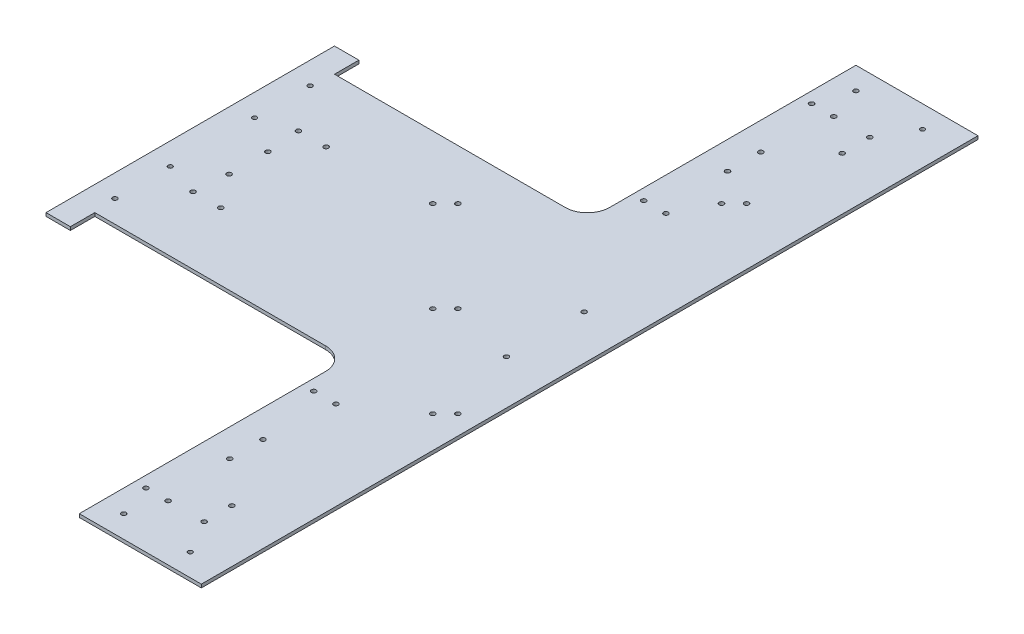
from build123d import *

# Parameters (mm, degrees)
BOSS_EXTRUDE1_DEPTH = 3
SKETCH2_R           = 2.125
CUT_EXTRUDE1_DEPTH  = 503.104570782
SKETCH3_R           = 2
CUT_EXTRUDE2_DEPTH  = 503.104570782
SKETCH5_R           = 2.125
CUT_EXTRUDE4_DEPTH  = 10
FILLET1_R           = 20
SKETCH6_R           = 2.125
CUT_EXTRUDE5_DEPTH  = 503.104570782
SKETCH8_R           = 2.1
CUT_EXTRUDE6_DEPTH  = 10
SKETCH7_R           = 2.1
CUT_EXTRUDE7_DEPTH  = 10
SKETCH9_W           = 360
SKETCH9_H           = 700
CUT_EXTRUDE8_DEPTH  = 10


with BuildPart() as part:
    # Sketch1 → Boss-Extrude1 (new body)
    with BuildSketch(Plane(origin=(0, 0, 0), x_dir=(1, 0, 0), z_dir=(0, 1, 0))):
        Polygon((-110, 350), (-110, 108), (-338, 108), (-338, 130), (-360, 130), (-360, -130), (-338, -130), (-338, -108), (-110, -108), (-110, -350), (110, -350), (110, -108), (338, -108), (338, -130), (360, -130), (360, 130), (338, 130), (338, 108), (110, 108), (110, 350), align=None)
    extrude(amount=BOSS_EXTRUDE1_DEPTH)

    # Sketch2 → Cut-Extrude1 (cut, through all)
    with BuildSketch(Plane(origin=(0, 3, 0), x_dir=(1, 0, 0), z_dir=(0, 1, 0))):
        with Locations(Location((310, 47.5, 0), (0, 0, 270))):
            Circle(SKETCH2_R)
        with Locations(Location((285, 47.5, 0), (0, 0, 270))):
            Circle(SKETCH2_R)
        with Locations(Location((307.5, 17.5, 0), (0, 0, 270))):
            Circle(SKETCH2_R)
        with Locations(Location((307.5, -17.5, 0), (0, 0, 270))):
            Circle(SKETCH2_R)
        with Locations(Location((310, -47.5, 0), (0, 0, 270))):
            Circle(SKETCH2_R)
        with Locations(Location((285, -47.5, 0), (0, 0, 270))):
            Circle(SKETCH2_R)
        with Locations(Location((-285, -47.5, 0), (0, 0, 90))):
            Circle(SKETCH2_R)
        with Locations(Location((-310, -47.5, 0), (0, 0, 90))):
            Circle(SKETCH2_R)
        with Locations(Location((-307.5, -17.5, 0), (0, 0, 90))):
            Circle(SKETCH2_R)
        with Locations(Location((-307.5, 17.5, 0), (0, 0, 90))):
            Circle(SKETCH2_R)
        with Locations(Location((-285, 47.5, 0), (0, 0, 90))):
            Circle(SKETCH2_R)
        with Locations(Location((-310, 47.5, 0), (0, 0, 90))):
            Circle(SKETCH2_R)
        with Locations(Location((47.5, 300, 0), (0, 0, 270))):
            Circle(SKETCH2_R)
        with Locations(Location((47.5, 275, 0), (0, 0, 270))):
            Circle(SKETCH2_R)
        with Locations(Location((-47.5, 275, 0), (0, 0, 90))):
            Circle(SKETCH2_R)
        with Locations(Location((-47.5, 300, 0), (0, 0, 90))):
            Circle(SKETCH2_R)
        with Locations(Location((-47.5, -300, 0), (0, 0, 270))):
            Circle(SKETCH2_R)
        with Locations(Location((-47.5, -275, 0), (0, 0, 270))):
            Circle(SKETCH2_R)
        with Locations(Location((47.5, -275, 0), (0, 0, 90))):
            Circle(SKETCH2_R)
        with Locations(Location((47.5, -300, 0), (0, 0, 90))):
            Circle(SKETCH2_R)
    extrude(amount=-CUT_EXTRUDE1_DEPTH, mode=Mode.SUBTRACT)

    # Sketch3 → Cut-Extrude2 (cut, through all)
    with BuildSketch(Plane(origin=(0, 3, 0), x_dir=(1, 0, 0), z_dir=(0, 1, 0))):
        with Locations(Location((340, 38, 0), (0, 0, 270))):
            Circle(SKETCH3_R)
        with Locations(Location((340, -38, 0), (0, 0, 90))):
            Circle(SKETCH3_R)
        with Locations(Location((-340, -38, 0), (0, 0, 270))):
            Circle(SKETCH3_R)
        with Locations(Location((-340, 38, 0), (0, 0, 90))):
            Circle(SKETCH3_R)
        with Locations(Location((-30, 330, 0), (0, 0, 270))):
            Circle(SKETCH3_R)
        with Locations(Location((30, 330, 0), (0, 0, 90))):
            Circle(SKETCH3_R)
        with Locations(Location((30, -330, 0), (0, 0, 270))):
            Circle(SKETCH3_R)
        with Locations(Location((-30, -330, 0), (0, 0, 90))):
            Circle(SKETCH3_R)
    extrude(amount=-CUT_EXTRUDE2_DEPTH, mode=Mode.SUBTRACT)

    # Sketch5 → Cut-Extrude4 (cut)
    with BuildSketch(Plane(origin=(0, 3, 0), x_dir=(1, 0, 0), z_dir=(0, 1, 0))):
        with Locations(Location((80, 300, 0), (0, 0, 270))):
            Circle(SKETCH5_R)
        with Locations(Location((80, 148.73, 0), (0, 0, 270))):
            Circle(SKETCH5_R)
        with Locations(Location((85.11, 239.365, 0), (0, 0, 270))):
            Circle(SKETCH5_R)
        with Locations(Location((85.11, 209.365, 0), (0, 0, 270))):
            Circle(SKETCH5_R)
        with Locations(Location((100, 148.73, 0), (0, 0, 90))):
            Circle(SKETCH5_R)
        with Locations(Location((100, 300, 0), (0, 0, 90))):
            Circle(SKETCH5_R)
        with Locations(Location((-100, 300, 0), (0, 0, 270))):
            Circle(SKETCH5_R)
        with Locations(Location((-100, 148.73, 0), (0, 0, 270))):
            Circle(SKETCH5_R)
        with Locations(Location((-85.11, 209.365, 0), (0, 0, 90))):
            Circle(SKETCH5_R)
        with Locations(Location((-85.11, 239.365, 0), (0, 0, 90))):
            Circle(SKETCH5_R)
        with Locations(Location((-80, 148.73, 0), (0, 0, 90))):
            Circle(SKETCH5_R)
        with Locations(Location((-80, 300, 0), (0, 0, 90))):
            Circle(SKETCH5_R)
        with Locations(Location((-80, -300, 0), (0, 0, 270))):
            Circle(SKETCH5_R)
        with Locations(Location((-80, -148.73, 0), (0, 0, 270))):
            Circle(SKETCH5_R)
        with Locations(Location((-85.11, -239.365, 0), (0, 0, 270))):
            Circle(SKETCH5_R)
        with Locations(Location((-85.11, -209.365, 0), (0, 0, 270))):
            Circle(SKETCH5_R)
        with Locations(Location((-100, -148.73, 0), (0, 0, 90))):
            Circle(SKETCH5_R)
        with Locations(Location((-100, -300, 0), (0, 0, 90))):
            Circle(SKETCH5_R)
        with Locations(Location((100, -300, 0), (0, 0, 270))):
            Circle(SKETCH5_R)
        with Locations(Location((100, -148.73, 0), (0, 0, 270))):
            Circle(SKETCH5_R)
        with Locations(Location((85.11, -209.365, 0), (0, 0, 90))):
            Circle(SKETCH5_R)
        with Locations(Location((85.11, -239.365, 0), (0, 0, 90))):
            Circle(SKETCH5_R)
        with Locations(Location((80, -148.73, 0), (0, 0, 90))):
            Circle(SKETCH5_R)
        with Locations(Location((80, -300, 0), (0, 0, 90))):
            Circle(SKETCH5_R)
    extrude(amount=-CUT_EXTRUDE4_DEPTH, mode=Mode.SUBTRACT)

    # Fillet1
    fillet1_edges = [part.edges().sort_by_distance(p)[0] for p in [
        (110, 1.5, -108),
        (110, 1.5, 108),
        (-110, 1.5, 108),
        (-110, 1.5, -108),
    ]]
    fillet(fillet1_edges, radius=FILLET1_R)

    # Sketch6 → Cut-Extrude5 (cut, through all)
    with BuildSketch(Plane(origin=(0, 3, 0), x_dir=(1, 0, 0), z_dir=(0, 1, 0))):
        with Locations(Location((53.325901808, -194.747258045, 0), (0, 0, 270))):
            Circle(SKETCH6_R)
        with Locations(Location((-192.747258045, 51.325901808, 0), (0, 0, 270))):
            Circle(SKETCH6_R)
        with Locations(Location((-28.69848481, -112.722871427, 0), (0, 0, 270))):
            Circle(SKETCH6_R)
        with Locations(Location((-110.722871427, -30.69848481, 0), (0, 0, 270))):
            Circle(SKETCH6_R)
        with Locations(Location((64.639610307, -183.433549546, 0), (0, 0, 90))):
            Circle(SKETCH6_R)
        with Locations(Location((-17.384776311, -101.409162928, 0), (0, 0, 90))):
            Circle(SKETCH6_R)
        with Locations(Location((-99.409162928, -19.384776311, 0), (0, 0, 90))):
            Circle(SKETCH6_R)
        with Locations(Location((-181.433549546, 62.639610307, 0), (0, 0, 90))):
            Circle(SKETCH6_R)
        with Locations(Location((-62.639610307, 181.433549546, 0), (0, 0, 270))):
            Circle(SKETCH6_R)
        with Locations(Location((19.384776311, 99.409162928, 0), (0, 0, 270))):
            Circle(SKETCH6_R)
        with Locations(Location((101.409162928, 17.384776311, 0), (0, 0, 270))):
            Circle(SKETCH6_R)
        with Locations(Location((183.433549546, -64.639610307, 0), (0, 0, 270))):
            Circle(SKETCH6_R)
        with Locations(Location((30.69848481, 110.722871427, 0), (0, 0, 90))):
            Circle(SKETCH6_R)
        with Locations(Location((112.722871427, 28.69848481, 0), (0, 0, 90))):
            Circle(SKETCH6_R)
        with Locations(Location((-51.325901808, 192.747258045, 0), (0, 0, 90))):
            Circle(SKETCH6_R)
        with Locations(Location((194.747258045, -53.325901808, 0), (0, 0, 90))):
            Circle(SKETCH6_R)
    extrude(amount=-CUT_EXTRUDE5_DEPTH, mode=Mode.SUBTRACT)

    # Sketch8 → Cut-Extrude6 (cut)
    with BuildSketch(Plane(origin=(0, 3, 0), x_dir=(1, 0, 0), z_dir=(0, 1, 0))):
        with Locations(Location((-40, 35, 0), (0, 0, 270))):
            Circle(SKETCH8_R)
        with Locations(Location((40, 35, 0), (0, 0, 90))):
            Circle(SKETCH8_R)
        with Locations(Location((40, -35, 0), (0, 0, 270))):
            Circle(SKETCH8_R)
        with Locations(Location((-40, -35, 0), (0, 0, 90))):
            Circle(SKETCH8_R)
    extrude(amount=-CUT_EXTRUDE6_DEPTH, mode=Mode.SUBTRACT)

    # Sketch7 → Cut-Extrude7 (cut)
    with BuildSketch(Plane(origin=(0, 3, 0), x_dir=(1, 0, 0), z_dir=(0, 1, 0))):
        with Locations(Location((340, 88, 0), (0, 0, 270))):
            Circle(SKETCH7_R)
        with Locations(Location((340, -88, 0), (0, 0, 90))):
            Circle(SKETCH7_R)
        with Locations(Location((-340, -88, 0), (0, 0, 270))):
            Circle(SKETCH7_R)
        with Locations(Location((-340, 88, 0), (0, 0, 90))):
            Circle(SKETCH7_R)
        with Locations(Location((-90, 330, 0), (0, 0, 270))):
            Circle(SKETCH7_R)
        with Locations(Location((90, 330, 0), (0, 0, 90))):
            Circle(SKETCH7_R)
        with Locations(Location((90, -330, 0), (0, 0, 270))):
            Circle(SKETCH7_R)
        with Locations(Location((-90, -330, 0), (0, 0, 90))):
            Circle(SKETCH7_R)
    extrude(amount=-CUT_EXTRUDE7_DEPTH, mode=Mode.SUBTRACT)

    # Sketch9 → Cut-Extrude8 (cut)
    with BuildSketch(Plane(origin=(0, 3, 0), x_dir=(1, 0, 0), z_dir=(0, 1, 0))):
        with Locations((180, 0)):
            Rectangle(SKETCH9_W, SKETCH9_H)
    extrude(amount=-CUT_EXTRUDE8_DEPTH, mode=Mode.SUBTRACT)


solid = part.part
